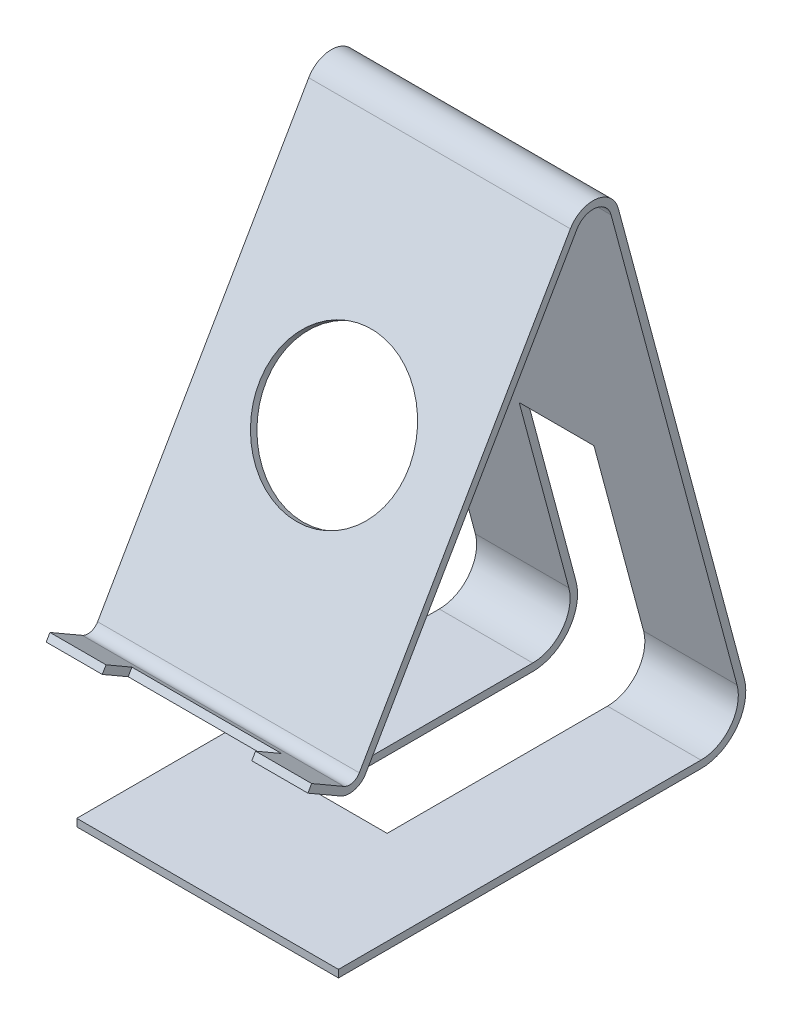
from build123d import *

# Parameters (mm, degrees)
EXTRUDE_THIN1_DEPTH = 70
SKETCH2_W           = 40
SKETCH2_H           = 8
CUT_EXTRUDE1_DEPTH  = 10
SKETCH3_W           = 20
SKETCH3_H           = 100
CUT_EXTRUDE2_DEPTH  = 90
SKETCH9_R           = 20
CUT_EXTRUDE9_DEPTH  = 2


with BuildPart() as part:
    # Sketch1 → Extrude-Thin1 (new body)
    with BuildSketch(Plane(origin=(0, 0, 0), x_dir=(0, 0, -1), z_dir=(1, 0, 0))):
        with BuildLine():
            Line((-38.022129, 0), (58.945617271, 0))
            ThreePointArc((58.945617271, 0), (66.879150674, 3.91238571), (68.604875534, 12.588190451))
            Line((68.604875534, 12.588190451), (34.909714379, 138.34024385))
            ThreePointArc((34.909714379, 138.34024385), (30.732716209, 142.003372931), (25.749958229, 139.546148624))
            Line((25.749958229, 139.546148624), (-30.714507865, 41.746824527))
            ThreePointArc((-30.714507865, 41.746824527), (-33.750539659, 39.417195395), (-37.544634884, 39.916697508))
            Line((-37.544634884, 39.916697508), (-46.204888922, 44.916697508))
            Line((-46.204888922, 44.916697508), (-45.204888922, 46.648748316))
            Line((-45.204888922, 46.648748316), (-36.544634884, 41.648748316))
            ThreePointArc((-36.544634884, 41.648748316), (-34.268177749, 41.349047048), (-32.446558673, 42.746824527))
            Line((-32.446558673, 42.746824527), (24.017907421, 140.546148624))
            ThreePointArc((24.017907421, 140.546148624), (30.993768593, 143.986262654), (36.841566032, 138.85788194))
            Line((36.841566032, 138.85788194), (70.536727187, 13.105828541))
            ThreePointArc((70.536727187, 13.105828541), (68.465857355, 2.694862852), (58.945617271, -2))
            Line((58.945617271, -2), (-38.022129, -2))
            Line((-38.022129, -2), (-38.022129, 0))
        make_face()
    extrude(amount=EXTRUDE_THIN1_DEPTH)

    # Sketch2 → Cut-Extrude1 (cut)
    with BuildSketch(Plane(origin=(0, 15.412270146, -8.898278318), x_dir=(1, 0, 0), z_dir=(0, 0.8660254037844438, -0.4999999999999912))):
        with Locations((35, -58.472956339)):
            Rectangle(SKETCH2_W, SKETCH2_H)
    extrude(amount=-CUT_EXTRUDE1_DEPTH, mode=Mode.SUBTRACT)

    # Sketch3 → Cut-Extrude2 (cut)
    with BuildSketch(Plane.XY):
        with Locations((35, 12.152835355)):
            Rectangle(SKETCH3_W, SKETCH3_H)
    extrude(amount=-CUT_EXTRUDE2_DEPTH, mode=Mode.SUBTRACT)

    # Sketch9 → Cut-Extrude9 (cut)
    with BuildSketch(Plane(origin=(0, 24.73647817, 42.84483699), x_dir=(1, 0, 0), z_dir=(0, 0.4999999999999915, 0.8660254037844435))):
        with Locations(Location((35, 77.261022729, 0), (0, 0, 270))):
            Circle(SKETCH9_R)
    extrude(amount=-CUT_EXTRUDE9_DEPTH, mode=Mode.SUBTRACT)


solid = part.part
